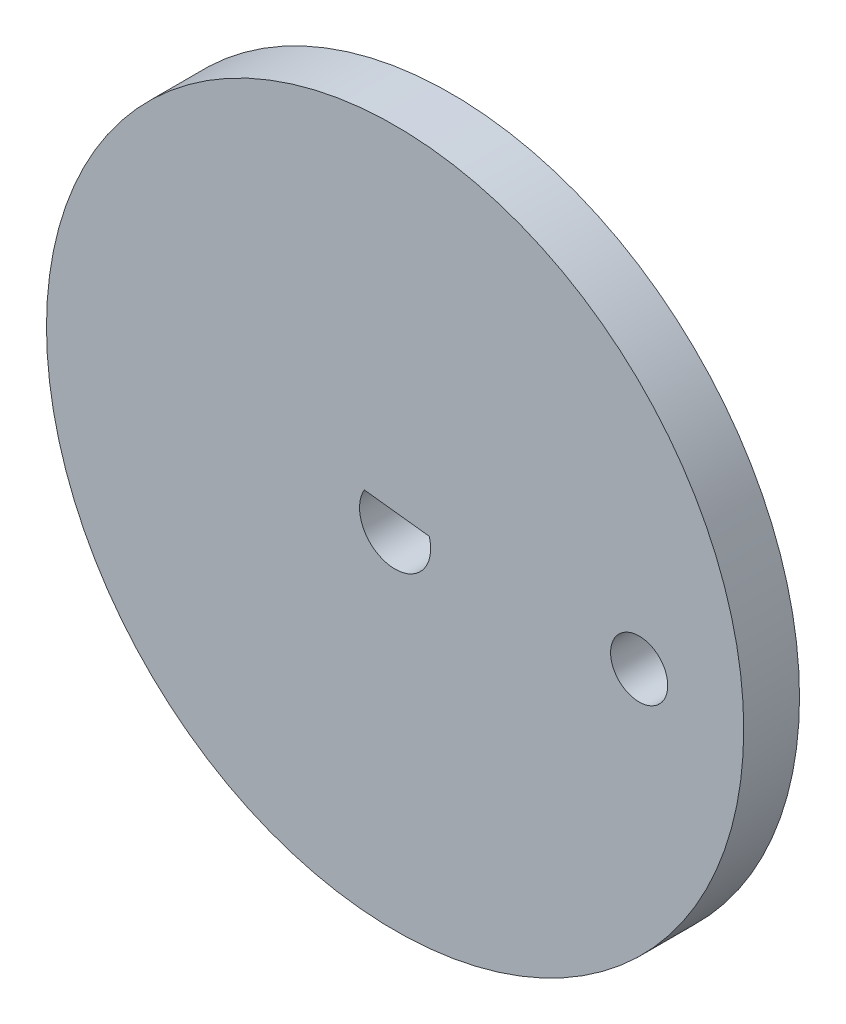
from build123d import *

# Parameters (mm, degrees)
SKETCH_1_R      = 50
SKETCH_1_R_2    = 4.1
EXTRUDE_1_DEPTH = 8


with BuildPart() as part:
    # 草图1 → 凸台-拉伸1 (new body)
    with BuildSketch(Plane.XY):
        Circle(SKETCH_1_R)
        with Locations((35, 0)):
            Circle(SKETCH_1_R_2, mode=Mode.SUBTRACT)
        with BuildLine():
            Line((4.89403723, 1.434712371), (-4.42388764, 2.537561456))
            ThreePointArc((-4.42388764, 2.537561456), (-0.599440727, -5.06464913), (4.89403723, 1.434712371))
        make_face(mode=Mode.SUBTRACT)
    extrude(amount=EXTRUDE_1_DEPTH)


solid = part.part
